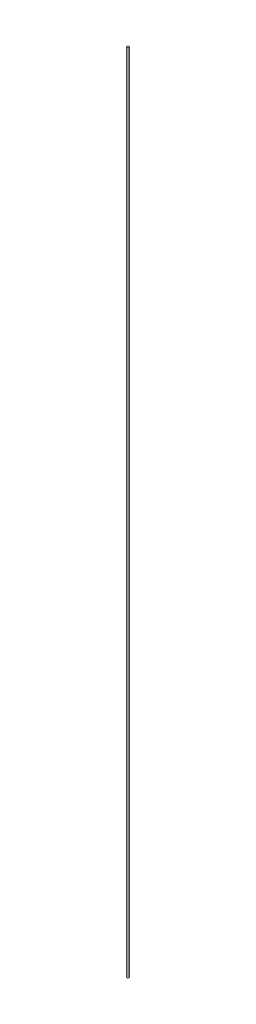
from build123d import *

# Parameters (mm, degrees)
SKETCH1_R     = 0.5
ANTENNA_DEPTH = 445


with BuildPart() as part:
    # Sketch1 → Antenna (new body)
    with BuildSketch(Plane(origin=(0, 0, 0), x_dir=(1, 0, 0), z_dir=(0, 1, 0))):
        with Locations(Location((0, 0, 0), (0, 0, 270))):
            Circle(SKETCH1_R)
    extrude(amount=ANTENNA_DEPTH)


solid = part.part
